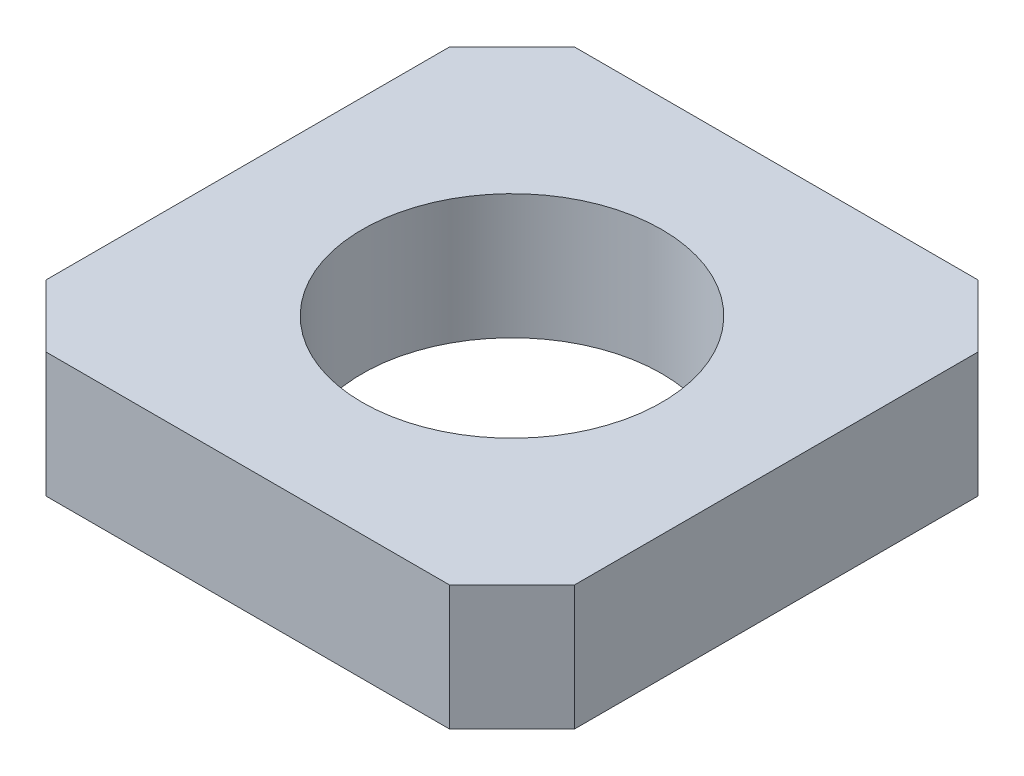
from build123d import *

# Parameters (mm, degrees)
SKETCH1_R          = 33.334829616
SKETCH1_R_2        = 12
EXTRUDE1_DEPTH     = 10
SKETCH2_W          = 68.7469374
SKETCH2_H          = 68.7469374
CUT_EXTRUDE1_DEPTH = 10


with BuildPart() as part:
    # Sketch1 → Extrude1 (new body)
    with BuildSketch(Plane(origin=(0, 0, 0), x_dir=(1, 0, 0), z_dir=(0, 1, 0))):
        with Locations(Location((0, 0, 0), (0, 0, 270))):
            Circle(SKETCH1_R)
        with Locations(Location((0, 0, 0), (0, 0, 270))):
            Circle(SKETCH1_R_2, mode=Mode.SUBTRACT)
    extrude(amount=EXTRUDE1_DEPTH)

    # Sketch2 → Cut-Extrude1 (cut)
    with BuildSketch(Plane.XZ):
        Rectangle(SKETCH2_W, SKETCH2_H)
        Polygon((16.16926222, 21.16926222), (21.16926222, 16.16926222), (21.16926222, -16.16926222), (16.16926222, -21.16926222), (-16.16926222, -21.16926222), (-21.16926222, -16.16926222), (-21.16926222, 16.16926222), (-16.16926222, 21.16926222), align=None, mode=Mode.SUBTRACT)
    extrude(amount=-CUT_EXTRUDE1_DEPTH, mode=Mode.SUBTRACT)


solid = part.part
